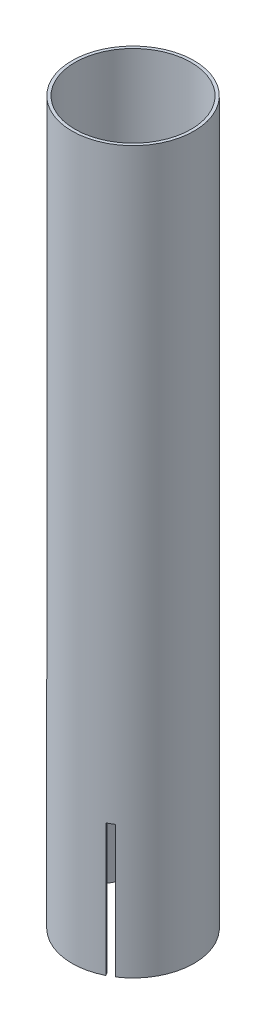
from build123d import *

# Parameters (mm, degrees)
SKETCH1_R           = 25.4
SKETCH1_R_2         = 24.15
BOSS_EXTRUDE1_DEPTH = 300
SKETCH2_W           = 3
SKETCH2_H           = 55
CUT_EXTRUDE1_DEPTH  = 35
CIRPATTERN1_COUNT   = 3


with BuildPart() as part:
    # Sketch1 → Boss-Extrude1 (new body)
    with BuildSketch(Plane(origin=(0, 0, 0), x_dir=(1, 0, 0), z_dir=(0, 1, 0))):
        with Locations(Location((0, 0, 0), (0, 0, 270))):
            Circle(SKETCH1_R)
        with Locations(Location((0, 0, 0), (0, 0, 270))):
            Circle(SKETCH1_R_2, mode=Mode.SUBTRACT)
    extrude(amount=BOSS_EXTRUDE1_DEPTH)

    # Sketch2 → Cut-Extrude1 (cut)
    with BuildSketch(Plane(origin=(0, 0, 0), x_dir=(0, 0, -1), z_dir=(1, 0, 0))):
        with Locations((0, 27.5)):
            Rectangle(SKETCH2_W, SKETCH2_H)
    cut_extrude1 = extrude(amount=-CUT_EXTRUDE1_DEPTH, mode=Mode.SUBTRACT)

    # CirPattern1: Cut-Extrude1 ×3 about axis
    cirpattern1_axis = Axis((0, 0, 0), (0, 1, 0))
    for i in range(1, CIRPATTERN1_COUNT):
        add(cut_extrude1.rotate(cirpattern1_axis, i * 360 / CIRPATTERN1_COUNT), mode=Mode.SUBTRACT)


solid = part.part
